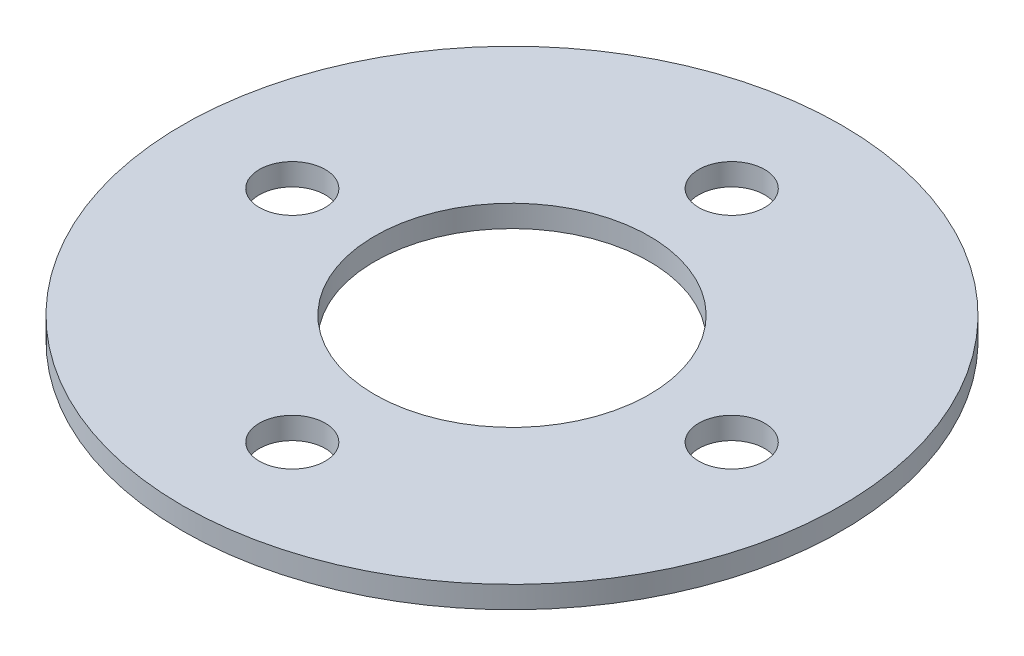
from build123d import *

# Parameters (mm, degrees)
SKETCH_1_R      = 15
SKETCH_1_R_2    = 6.25
SKETCH_1_R_3    = 1.5
EXTRUDE_1_DEPTH = 1


with BuildPart() as part:
    # 草图1 → 凸台-拉伸1 (new body)
    with BuildSketch(Plane(origin=(0, 0, 0), x_dir=(1, 0, 0), z_dir=(0, 1, 0))):
        with Locations(Location((0, 0, 0), (0, 0, 270))):
            Circle(SKETCH_1_R)
        with Locations(Location((0, 0, 0), (0, 0, 270))):
            Circle(SKETCH_1_R_2, mode=Mode.SUBTRACT)
        with Locations(Location((0, 10, 0), (0, 0, 270))):
            Circle(SKETCH_1_R_3, mode=Mode.SUBTRACT)
        with Locations(Location((10, 0, 0), (0, 0, 270))):
            Circle(SKETCH_1_R_3, mode=Mode.SUBTRACT)
        with Locations(Location((0, -10, 0), (0, 0, 270))):
            Circle(SKETCH_1_R_3, mode=Mode.SUBTRACT)
        with Locations(Location((-10, 0, 0), (0, 0, 270))):
            Circle(SKETCH_1_R_3, mode=Mode.SUBTRACT)
    extrude(amount=EXTRUDE_1_DEPTH)


solid = part.part
